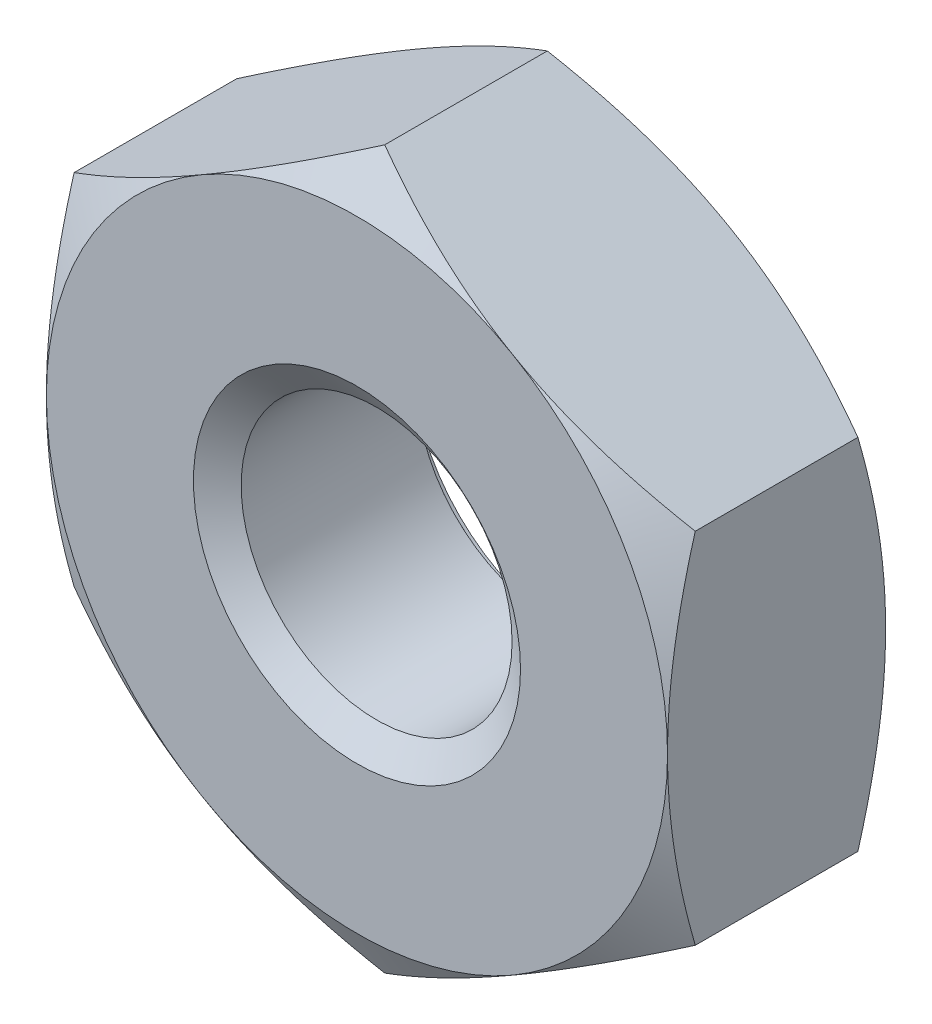
from build123d import *

# Parameters (mm, degrees)
BASENUT_START = -1.6764
BASENUTSKE_R  = 1.0414
BASENUT_DEPTH = 1.6764


with BuildPart() as part:
    # BaseNutSke → BaseNut (new body)
    with BuildSketch(Plane.XY.offset(BASENUT_START)):
        Polygon((2.3876, 1.378481503), (2.3876, -1.378481503), (0, -2.756963005), (-2.3876, -1.378481503), (-2.3876, 1.378481503), (0, 2.756963005), align=None)
        Circle(BASENUTSKE_R, mode=Mode.SUBTRACT)
    extrude(amount=BASENUT_DEPTH)

    # Sketch3 → Double-Chamfer (revolve, cut)
    with BuildSketch(Plane(origin=(0, 0, 0), x_dir=(0, 0, -1), z_dir=(1, 0, 0))):
        Polygon((1.6764, 2.3876), (1.463148169, 2.756963005), (1.463148169, 15.456963005), (14.3764, 15.456963005), (14.3764, 2.3876), align=None)
        Polygon((0.213251831, 15.456963005), (-12.7, 15.456963005), (-12.7, 2.3876), (0, 2.3876), (0.213251831, 2.756963005), align=None)
    revolve(axis=Axis((0, 0, 0), (0, 0, -1)), mode=Mode.SUBTRACT)

    # EndChamferSketch → EndChamfer (revolve, cut)
    with BuildSketch(Plane(origin=(0, 0, 0), x_dir=(0, 0, -1), z_dir=(1, 0, 0)), mode=Mode.PRIVATE) as endchamfer_sk:
        Polygon((1.651, 1.2573), (1.484707712, 1.01981), (1.7018, 1.01981), (1.7018, 1.2573), align=None)
        Polygon((-0.0508, 1.2573), (0, 1.2573), (0.166292288, 1.01981), (-0.0508, 1.01981), align=None)
    revolve(endchamfer_sk.sketch.rotate(Axis((0, 0, -25.037505729), (0, 0, -1)), 90), axis=Axis((0, 0, -25.037505729), (0, 0, -1)), mode=Mode.SUBTRACT)


solid = part.part
